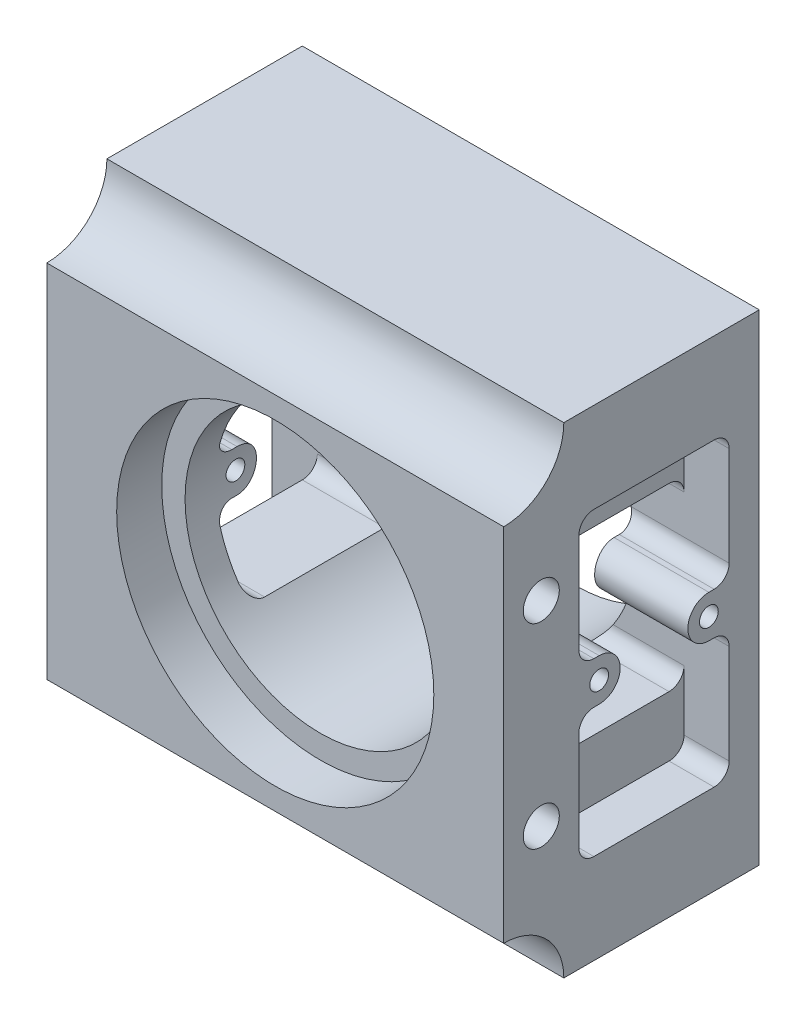
from build123d import *

# Parameters (mm, degrees)
SKETCH_1_W             = 30.4
SKETCH_1_H             = 32
EXTRUDE_1_DEPTH        = 10
SKETCH_2_R             = 9
CUT_EXTRUDE_1_DEPTH    = 30.78321675
SKETCH_3_R             = 10.55
CUT_EXTRUDE_2_DEPTH    = 3
SKETCH_4_W             = 4.5
SKETCH_4_H             = 12
CUT_EXTRUDE_3_DEPTH    = 36.779323638
CUT_EXTRUDE_4_DEPTH    = 36.779323638
HOLE_WIZARD_M1_6_1_D   = 1.25
SKETCH_8_W             = 10
SKETCH_8_H             = 4
CUT_EXTRUDE_5_DEPTH    = 3
SKETCH_9_W             = 10
SKETCH_9_H             = 4
CUT_EXTRUDE_6_DEPTH    = 3
FILLET_1_R             = 1
SKETCH_10_W            = 30.4
SKETCH_10_H            = 32
SKETCH_10_R            = 10.5
CUT_EXTRUDE_7_DEPTH    = 3
HOLE_WIZARD_M3_1_D     = 2.5
HOLE_WIZARD_M3_1_DEPTH = 6.5
HOLE_WIZARD_M3_1_TIP   = 0.751075774
HOLE_WIZARD_M3_2_D     = 2.5
HOLE_WIZARD_M3_2_DEPTH = 4.5
HOLE_WIZARD_M3_2_TIP   = 0.751075774
SKETCH_16_R            = 4
CUT_EXTRUDE_8_DEPTH    = 36.779323751
SKETCH_17_R            = 1.2
CUT_EXTRUDE_9_DEPTH    = 5


with BuildPart() as part:
    # 草图1 → 凸台-拉伸1 (new, symmetric)
    with BuildSketch(Plane.XY):
        Rectangle(SKETCH_1_W, SKETCH_1_H)
    extrude(amount=EXTRUDE_1_DEPTH, both=True)

    # 草图2 → 切除-拉伸1 (cut, through all)
    with BuildSketch(Plane.XY.offset(10)):
        Circle(SKETCH_2_R)
    extrude(amount=-CUT_EXTRUDE_1_DEPTH, mode=Mode.SUBTRACT)

    # 草图3 → 切除-拉伸2 (cut)
    with BuildSketch(Plane.XY.offset(10)):
        Circle(SKETCH_3_R)
    extrude(amount=-CUT_EXTRUDE_2_DEPTH, mode=Mode.SUBTRACT)

    # 草图4 → 切除-拉伸3 (cut, through all)
    with BuildSketch(Plane(origin=(15.2, 0, 0), x_dir=(0, 0, -1), z_dir=(1, 0, 0))):
        Rectangle(SKETCH_4_W, SKETCH_4_H)
    extrude(amount=-CUT_EXTRUDE_3_DEPTH, mode=Mode.SUBTRACT)

    # 草图5 → 切除-拉伸4 (cut, through all)
    with BuildSketch(Plane(origin=(15.2, 0, 0), x_dir=(0, 0, -1), z_dir=(1, 0, 0))):
        with BuildLine():
            Line((5, 6), (2.25, 6))
            Line((2.25, 6), (2.25, 0))
            ThreePointArc((2.25, 0), (2.660050506, 0.989949494), (3.65, 1.4))
            Line((3.65, 1.4), (5, 1.4))
            Line((5, 1.4), (5, 6))
        make_face()
        with BuildLine():
            ThreePointArc((3.65, -1.4), (2.660050506, -0.989949494), (2.25, 0))
            Line((2.25, 0), (2.25, -6))
            Line((2.25, -6), (5, -6))
            Line((5, -6), (5, -1.4))
            Line((5, -1.4), (3.65, -1.4))
        make_face()
        with BuildLine():
            Line((-2.25, -6), (-2.25, 0))
            ThreePointArc((-2.25, 0), (-2.660050506, -0.989949494), (-3.65, -1.4))
            Line((-3.65, -1.4), (-5, -1.4))
            Line((-5, -1.4), (-5, -6))
            Line((-5, -6), (-2.25, -6))
        make_face()
        with BuildLine():
            Line((-2.25, 0), (-2.25, 6))
            Line((-2.25, 6), (-5, 6))
            Line((-5, 6), (-5, 1.4))
            Line((-5, 1.4), (-3.65, 1.4))
            ThreePointArc((-3.65, 1.4), (-2.660050506, 0.989949494), (-2.25, 0))
        make_face()
    extrude(amount=-CUT_EXTRUDE_4_DEPTH, mode=Mode.SUBTRACT)

    # M1.6 螺纹孔1 (through all)
    with Locations(Plane(origin=(15.2, 0, 3.65), x_dir=(0, 0, 1), z_dir=(1, 0, 0))):
        with Locations((0, 0), (-7.3, 0)):
            Hole(HOLE_WIZARD_M1_6_1_D / 2)

    # 草图8 → 切除-拉伸5 (cut)
    with BuildSketch(Plane(origin=(15.2, 0, 0), x_dir=(0, 0, -1), z_dir=(1, 0, 0))):
        with Locations((0, 8)):
            Rectangle(SKETCH_8_W, SKETCH_8_H)
        with Locations((0, -8)):
            Rectangle(SKETCH_8_W, SKETCH_8_H)
    extrude(amount=-CUT_EXTRUDE_5_DEPTH, mode=Mode.SUBTRACT)

    # 草图9 → 切除-拉伸6 (cut)
    with BuildSketch(Plane.ZY.offset(15.2)):
        with Locations((0, -8)):
            Rectangle(SKETCH_9_W, SKETCH_9_H)
        with Locations((0, 8)):
            Rectangle(SKETCH_9_W, SKETCH_9_H)
    extrude(amount=-CUT_EXTRUDE_6_DEPTH, mode=Mode.SUBTRACT)

    # 圆角1
    fillet_1_edges = [part.edges().sort_by_distance(p)[0] for p in [
        (-12.045222154, -1.4, -5),
        (12.045222154, -1.4, -5),
        (9.454101966, -6, -5),
        (9.454101966, -6, 5),
        (-12.045222154, -1.4, 5),
        (12.045222154, -1.4, 5),
        (13.7, 10, 5),
        (13.7, 10, -5),
        (13.7, -10, 5),
        (13.7, -10, -5),
        (-9.454101966, -6, -5),
        (-9.454101966, -6, 5),
        (-9.454101966, 6, 5),
        (-9.454101966, 6, -5),
        (-13.7, -10, 5),
        (-13.7, -10, -5),
        (-13.7, 10, -5),
        (-13.7, 10, 5),
        (9.454101966, 6, -5),
        (12.045222154, 1.4, -5),
        (-12.045222154, 1.4, -5),
        (-12.045222154, 1.4, 5),
        (12.045222154, 1.4, 5),
        (9.454101966, 6, 5),
    ]]
    fillet(fillet_1_edges, radius=FILLET_1_R)

    # 草图10 → 切除-拉伸7 (cut)
    with BuildSketch(Plane(origin=(0, 0, -10), x_dir=(-1, 0, 0), z_dir=(0, 0, -1))):
        Rectangle(SKETCH_10_W, SKETCH_10_H)
        Circle(SKETCH_10_R, mode=Mode.SUBTRACT)
    extrude(amount=-CUT_EXTRUDE_7_DEPTH, mode=Mode.SUBTRACT)

    # M3 螺纹孔1
    with Locations(Plane(origin=(-8, -16, 2), x_dir=(-1, 0, 0), z_dir=(0, -1, 0))):
        with Locations((0, 0), (-16, 0)):
            Hole(HOLE_WIZARD_M3_1_D / 2, depth=HOLE_WIZARD_M3_1_DEPTH)
            with Locations((0, 0, -(HOLE_WIZARD_M3_1_DEPTH + HOLE_WIZARD_M3_1_TIP / 2))):  # 118° drill point
                Cone(0, HOLE_WIZARD_M3_1_D / 2, HOLE_WIZARD_M3_1_TIP, mode=Mode.SUBTRACT)

    # M3 螺纹孔2
    with Locations(Plane(origin=(13, 13, -7), x_dir=(-1, 0, 0), z_dir=(0, 0, -1))):
        with Locations((0, 0), (26, 0), (26, -26), (0, -26)):
            Hole(HOLE_WIZARD_M3_2_D / 2, depth=HOLE_WIZARD_M3_2_DEPTH)
            with Locations((0, 0, -(HOLE_WIZARD_M3_2_DEPTH + HOLE_WIZARD_M3_2_TIP / 2))):  # 118° drill point
                Cone(0, HOLE_WIZARD_M3_2_D / 2, HOLE_WIZARD_M3_2_TIP, mode=Mode.SUBTRACT)

    # 草图16 → 切除-拉伸8 (cut, through all)
    with BuildSketch(Plane(origin=(15.2, 0, 0), x_dir=(0, 0, -1), z_dir=(1, 0, 0))):
        with Locations((-10, -16)):
            Circle(SKETCH_16_R)
        with Locations((-10, 16)):
            Circle(SKETCH_16_R)
    extrude(amount=-CUT_EXTRUDE_8_DEPTH, mode=Mode.SUBTRACT)

    # 草图17 → 切除-拉伸9 (cut)
    with BuildSketch(Plane(origin=(15.2, 0, 0), x_dir=(0, 0, -1), z_dir=(1, 0, 0))):
        with Locations((-7.5, -6.5)):
            Circle(SKETCH_17_R)
        with Locations((-7.5, 6.5)):
            Circle(SKETCH_17_R)
    extrude(amount=-CUT_EXTRUDE_9_DEPTH, mode=Mode.SUBTRACT)


solid = part.part
